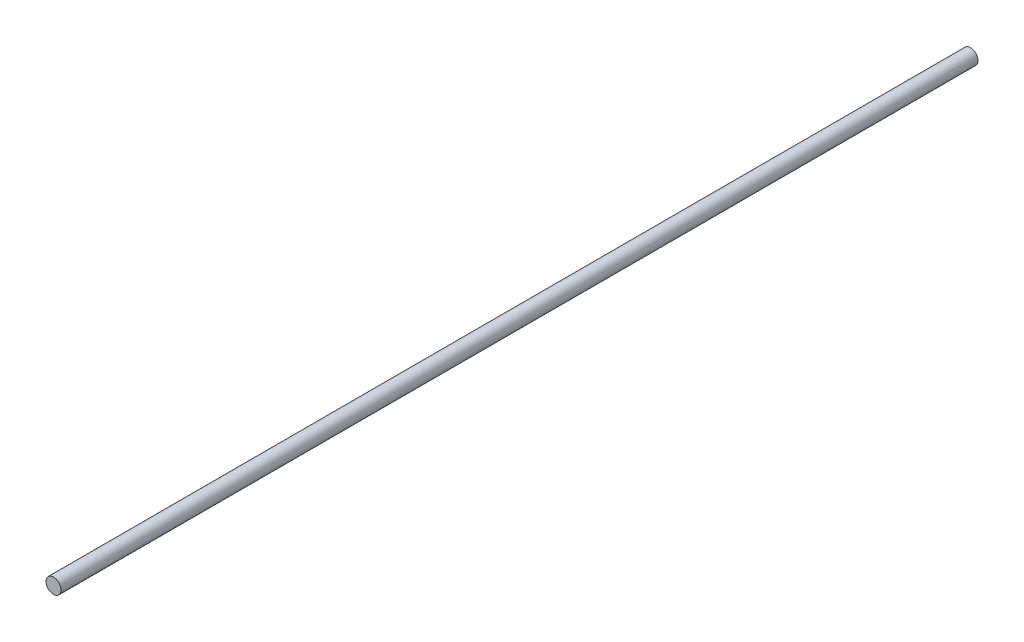
from build123d import *

# Parameters (mm, degrees)
SKETCH1_R           = 6.35
BOSS_EXTRUDE1_DEPTH = 774.7


with BuildPart() as part:
    # Sketch1 → Boss-Extrude1 (new body)
    with BuildSketch(Plane.XY):
        Circle(SKETCH1_R)
    extrude(amount=-BOSS_EXTRUDE1_DEPTH)


solid = part.part
